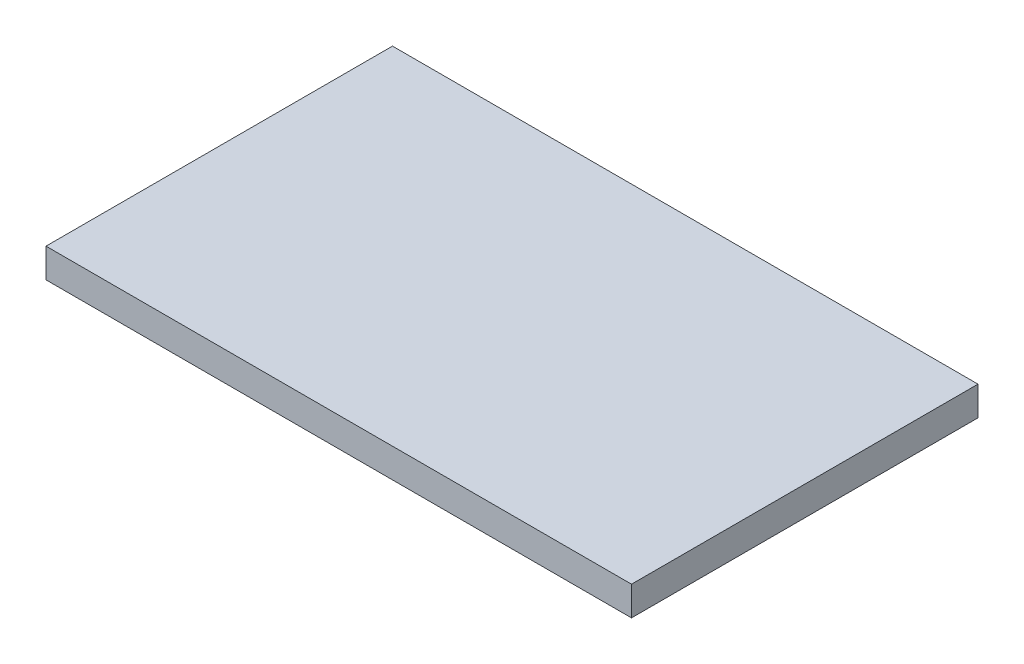
from build123d import *

# Parameters (mm, degrees)
BOSS_EXTRUDE1_DEPTH = 226


with BuildPart() as part:
    # Sketch1 → Boss-Extrude1 (new body)
    with BuildSketch(Plane.XY):
        Polygon((-190.95, -151.565734031), (-190.95, -142.040734031), (190.95, -142.040734031), (190.95, -161.090734031), (-190.95, -161.090734031), align=None)
    extrude(amount=BOSS_EXTRUDE1_DEPTH)


solid = part.part
